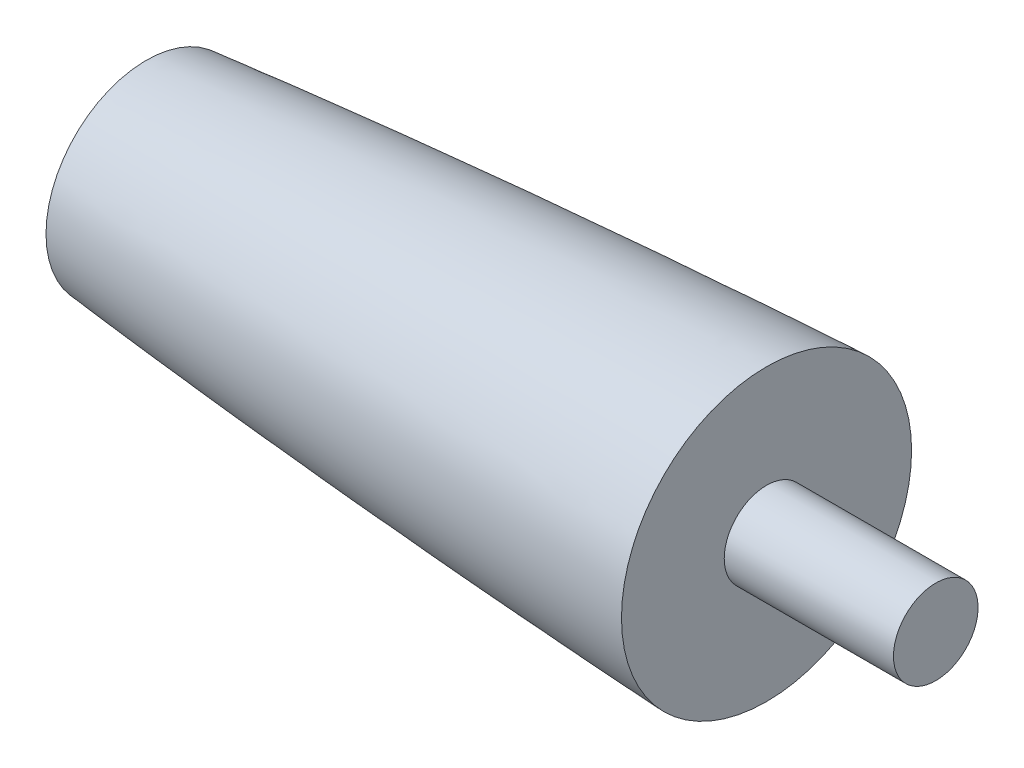
from build123d import *

# Parameters (mm, degrees)
SKETCH2_R          = 12.7
CUT_EXTRUDE1_DEPTH = 50.8


with BuildPart() as part:
    # Sketch1 → Revolve1 (revolve)
    with BuildSketch(Plane(origin=(0, 0, 0), x_dir=(1, 0, 0), z_dir=(0, 1, 0)), mode=Mode.PRIVATE) as revolve1_sk:
        with BuildLine():
            Line((186.200000001, 30.088313688), (186.200000001, 0))
            Line((186.200000001, 0), (423.200000001, 0))
            Line((423.200000001, 0), (423.200000001, 12.700000001))
            Line((423.200000001, 12.700000001), (372.400000001, 12.700000001))
            Line((372.400000001, 12.700000001), (372.400000001, 43.541276181))
            add(Edge.make_bspline(
                [(186.200000001, 30.088313688), (186.847714315, 30.152492057), (188.168214127, 30.282777799), (191.919274255, 30.651131842), (196.125115808, 31.056346969), (201.841921663, 31.599979436), (207.89502363, 32.161102357), (214.20707283, 32.735571964), (220.370330952, 33.283242127), (226.624337906, 33.828071245), (232.825098634, 34.356026341), (239.059679793, 34.875915666), (245.275292167, 35.382744259), (251.503725386, 35.879780312), (259.130032911, 36.47499837), (268.320529045, 37.171832554), (279.061816884, 37.956877854), (289.816198167, 38.708210609), (299.152723668, 39.335926683), (306.952841489, 39.843807653), (313.162009425, 40.238960034), (319.434498319, 40.627707013), (325.596967327, 41.001641586), (331.946600138, 41.375412088), (337.986917368, 41.724803954), (344.539308291, 42.090097859), (350.249018575, 42.40507892), (357.350114047, 42.77914072), (362.14869502, 43.031603434), (368.611231025, 43.35442242), (371.099783503, 43.477654205), (372.400000001, 43.541276181)],
                knots=[0.082770027, 0.082770027, 0.082770027, 0.082770027, 0.082770027, 0.096714773, 0.110659518, 0.138549007, 0.166438498, 0.194327987, 0.222217477, 0.250106966, 0.277996456, 0.305885945, 0.333775435, 0.361664925, 0.389554415, 0.417443904, 0.470505446, 0.526284425, 0.582063404, 0.609952894, 0.637842384, 0.665731874, 0.693621363, 0.721510853, 0.749400343, 0.777289832, 0.805179322, 0.833068812, 0.860958301, 0.888847791, 0.916737281, 0.916737281, 0.916737281, 0.916737281, 0.916737281], degree=4))
        make_face()
    revolve(revolve1_sk.sketch.rotate(Axis((186.200000001, 0, 0), (1, 0, 0)), 180), axis=Axis((186.200000001, 0, 0), (1, 0, 0)))

    # Sketch2 → Cut-Extrude1 (cut)
    with BuildSketch(Plane.ZY.offset(-186.200000001)):
        Circle(SKETCH2_R)
    extrude(amount=-CUT_EXTRUDE1_DEPTH, mode=Mode.SUBTRACT)


solid = part.part
